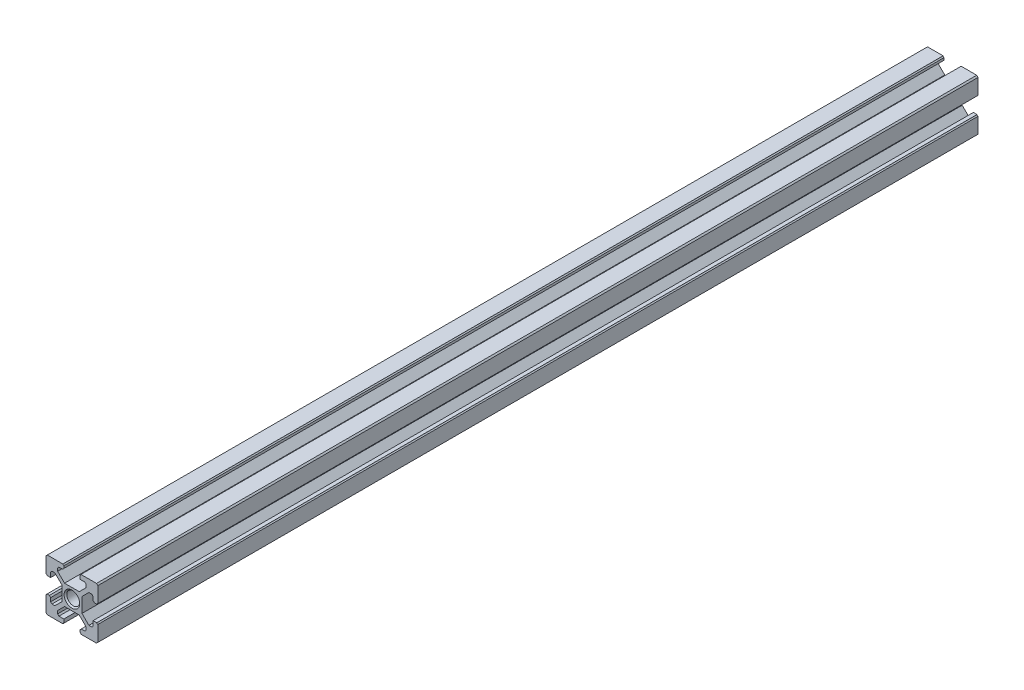
from build123d import *

# Parameters (mm, degrees)
BOSS_EXTRUDE1_DEPTH             = 340
M6X1_0_TAPPED_HOLE2_D           = 5
M6X1_0_TAPPED_HOLE2_DEPTH       = 28.497848452
M6X1_0_TAPPED_HOLE2_CSINK_D     = 6.05
M6X1_0_TAPPED_HOLE2_CSINK_ANGLE = 90
M6X1_0_TAPPED_HOLE2_TIP         = 1.502151548


with BuildPart() as part:
    # Sketch1 → Boss-Extrude1 (new body)
    with BuildSketch(Plane.XY):
        with BuildLine():
            Line((-9.5, 10), (-3.486470896, 10))
            ThreePointArc((-3.486470896, 10), (-3.373276191, 9.726723809), (-3.1, 9.613529104))
            Line((-3.1, 9.613529104), (-3.1, 8.7))
            Line((-3.1, 8.7), (-3.6, 8.2))
            Line((-3.6, 8.2), (-5, 8.2))
            Line((-5, 8.2), (-5.5, 7.7))
            Line((-5.5, 7.7), (-5.5, 6.560660172))
            Line((-5.5, 6.560660172), (-2.839339828, 3.9))
            Line((-2.839339828, 3.9), (0, 3.9))
            Line((0, 3.9), (2.839339828, 3.9))
            Line((2.839339828, 3.9), (5.5, 6.560660172))
            Line((5.5, 6.560660172), (5.5, 7.7))
            Line((5.5, 7.7), (5, 8.2))
            Line((5, 8.2), (3.1, 8.2))
            Line((3.1, 8.2), (3.1, 9.613529104))
            ThreePointArc((3.1, 9.613529104), (3.373276191, 9.726723809), (3.486470896, 10))
            Line((3.486470896, 10), (9.5, 10))
            Line((9.5, 10), (10, 9.5))
            Line((10, 9.5), (10, 3.486470896))
            ThreePointArc((10, 3.486470896), (9.726723809, 3.373276191), (9.613529104, 3.1))
            Line((9.613529104, 3.1), (8.7, 3.1))
            Line((8.7, 3.1), (8.2, 3.6))
            Line((8.2, 3.6), (8.2, 5))
            Line((8.2, 5), (7.7, 5.5))
            Line((7.7, 5.5), (6.560660172, 5.5))
            Line((6.560660172, 5.5), (3.9, 2.839339828))
            Line((3.9, 2.839339828), (3.9, 0))
            Line((3.9, 0), (3.9, -2.839339828))
            Line((3.9, -2.839339828), (6.560660172, -5.5))
            Line((6.560660172, -5.5), (7.7, -5.5))
            Line((7.7, -5.5), (8.2, -5))
            Line((8.2, -5), (8.2, -3.1))
            Line((8.2, -3.1), (9.613529104, -3.1))
            ThreePointArc((9.613529104, -3.1), (9.726723809, -3.373276191), (10, -3.486470896))
            Line((10, -3.486470896), (10, -9.5))
            Line((10, -9.5), (9.5, -10))
            Line((9.5, -10), (3.486470896, -10))
            ThreePointArc((3.486470896, -10), (3.373276191, -9.726723809), (3.1, -9.613529104))
            Line((3.1, -9.613529104), (3.1, -8.7))
            Line((3.1, -8.7), (3.6, -8.2))
            Line((3.6, -8.2), (5, -8.2))
            Line((5, -8.2), (5.5, -7.7))
            Line((5.5, -7.7), (5.5, -6.560660172))
            Line((5.5, -6.560660172), (2.839339828, -3.9))
            Line((2.839339828, -3.9), (0, -3.9))
            Line((0, -3.9), (-2.839339828, -3.9))
            Line((-2.839339828, -3.9), (-5.5, -6.560660172))
            Line((-5.5, -6.560660172), (-5.5, -7.7))
            Line((-5.5, -7.7), (-5, -8.2))
            Line((-5, -8.2), (-3.1, -8.2))
            Line((-3.1, -8.2), (-3.1, -9.613529104))
            ThreePointArc((-3.1, -9.613529104), (-3.373276191, -9.726723809), (-3.486470896, -10))
            Line((-3.486470896, -10), (-9.5, -10))
            Line((-9.5, -10), (-10, -9.5))
            Line((-10, -9.5), (-10, -3.486470896))
            ThreePointArc((-10, -3.486470896), (-9.726723809, -3.373276191), (-9.613529104, -3.1))
            Line((-9.613529104, -3.1), (-8.7, -3.1))
            Line((-8.7, -3.1), (-8.2, -3.6))
            Line((-8.2, -3.6), (-8.2, -5))
            Line((-8.2, -5), (-7.7, -5.5))
            Line((-7.7, -5.5), (-6.560660172, -5.5))
            Line((-6.560660172, -5.5), (-3.9, -2.839339828))
            Line((-3.9, -2.839339828), (-3.9, 0))
            Line((-3.9, 0), (-3.9, 2.839339828))
            Line((-3.9, 2.839339828), (-6.560660172, 5.5))
            Line((-6.560660172, 5.5), (-7.7, 5.5))
            Line((-7.7, 5.5), (-8.2, 5))
            Line((-8.2, 5), (-8.2, 3.1))
            Line((-8.2, 3.1), (-9.613529104, 3.1))
            ThreePointArc((-9.613529104, 3.1), (-9.726723809, 3.373276191), (-10, 3.486470896))
            Line((-10, 3.486470896), (-10, 9.5))
            Line((-10, 9.5), (-9.5, 10))
        make_face()
    extrude(amount=BOSS_EXTRUDE1_DEPTH)

    # Sketch2 → M6x1.0 Tapped Hole1 (revolve, cut)
    with BuildSketch(Plane(origin=(0, 0, 340), x_dir=(0, -1, 0), z_dir=(1, 0, 0))):
        Polygon((0, 0), (0, 30), (2.5, 28.497848452), (2.5, 0.525), (3.025, 0), align=None)
    revolve(axis=Axis((0, 0, 346.35), (0, 0, -1)), mode=Mode.SUBTRACT)

    # M6x1.0 Tapped Hole2
    with Locations(Plane(origin=(0, 0, 0), x_dir=(-1, 0, 0), z_dir=(0, 0, -1))):
        with Locations((0, 0)):
            CounterSinkHole(M6X1_0_TAPPED_HOLE2_D / 2, M6X1_0_TAPPED_HOLE2_CSINK_D / 2, depth=M6X1_0_TAPPED_HOLE2_DEPTH, counter_sink_angle=M6X1_0_TAPPED_HOLE2_CSINK_ANGLE)
            with Locations((0, 0, -(M6X1_0_TAPPED_HOLE2_DEPTH + M6X1_0_TAPPED_HOLE2_TIP / 2))):  # 118° drill point
                Cone(0, M6X1_0_TAPPED_HOLE2_D / 2, M6X1_0_TAPPED_HOLE2_TIP, mode=Mode.SUBTRACT)


solid = part.part
